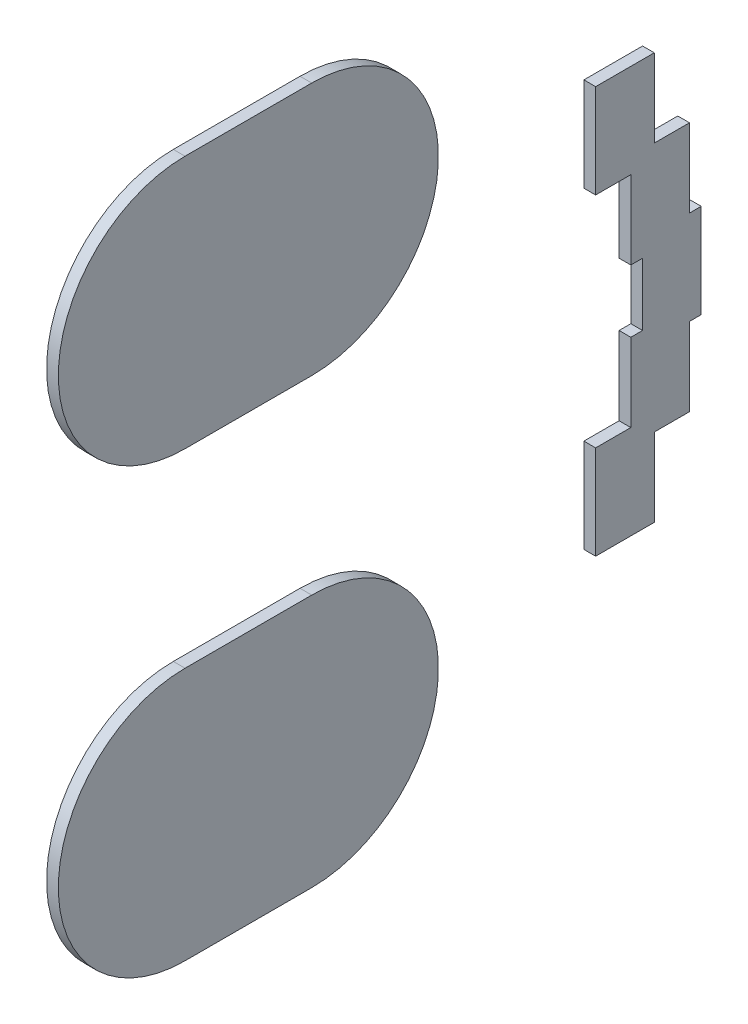
from build123d import *

# Parameters (mm, degrees)
S_BOX1_W      = 0.3
S_BOX1_H      = 6.48
BOSS_1_DEPTH  = 3.24
S_CYL2_R      = 3.24
BOSS_2_DEPTH  = 0.3
S_CYL3_R      = 3.24
BOSS_3_DEPTH  = 0.3
S_BOX4_W      = 0.3
S_BOX4_H      = 6.48
BOSS_4_DEPTH  = 3.24
S_CYL5_R      = 3.24
BOSS_5_DEPTH  = 0.3
S_CYL6_R      = 3.24
BOSS_6_DEPTH  = 0.3
S_BOX7_W      = 0.3
S_BOX7_H      = 2.4
BOSS_7_DEPTH  = 1.5
S_BOX8_W      = 0.3
S_BOX8_H      = 2.4
BOSS_8_DEPTH  = 1.5
S_BOX9_W      = 0.3
S_BOX9_H      = 2.4
BOSS_9_DEPTH  = 1.5
S_BOX10_W     = 0.3
S_BOX10_H     = 2.4
BOSS_10_DEPTH = 1.5
S_BOX11_W     = 0.3
S_BOX11_H     = 2.4
BOSS_11_DEPTH = 1.5


with BuildPart() as part:
    # S_box1 → Boss_1 (new body)
    with BuildSketch(Plane.XY.offset(30.81)):
        with Locations((29.65, 5.67)):
            Rectangle(S_BOX1_W, S_BOX1_H)
    extrude(amount=BOSS_1_DEPTH)

    # S_cyl2 → Boss_2 (add)
    with BuildSketch(Plane(origin=(29.5, 0, 0), x_dir=(0, 0, -1), z_dir=(1, 0, 0))):
        with Locations((-30.81, 5.67)):
            Circle(S_CYL2_R)
    extrude(amount=BOSS_2_DEPTH)

    # S_cyl3 → Boss_3 (add)
    with BuildSketch(Plane(origin=(29.5, 0, 0), x_dir=(0, 0, -1), z_dir=(1, 0, 0))):
        with Locations((-34.05, 5.67)):
            Circle(S_CYL3_R)
    extrude(amount=BOSS_3_DEPTH)


with BuildPart() as body_2:
    # S_box4 → Boss_4 (new body)
    with BuildSketch(Plane.XY.offset(30.81)):
        with Locations((29.65, -5.67)):
            Rectangle(S_BOX4_W, S_BOX4_H)
    extrude(amount=BOSS_4_DEPTH)

    # S_cyl5 → Boss_5 (add)
    with BuildSketch(Plane(origin=(29.5, 0, 0), x_dir=(0, 0, -1), z_dir=(1, 0, 0))):
        with Locations((-30.81, -5.67)):
            Circle(S_CYL5_R)
    extrude(amount=BOSS_5_DEPTH)

    # S_cyl6 → Boss_6 (add)
    with BuildSketch(Plane(origin=(29.5, 0, 0), x_dir=(0, 0, -1), z_dir=(1, 0, 0))):
        with Locations((-34.05, -5.67)):
            Circle(S_CYL6_R)
    extrude(amount=BOSS_6_DEPTH)


with BuildPart() as body_3:
    # S_box7 → Boss_7 (new body)
    with BuildSketch(Plane.XY.offset(22.05)):
        with Locations((29.65, -4)):
            Rectangle(S_BOX7_W, S_BOX7_H)
    extrude(amount=BOSS_7_DEPTH)

    # S_box8 → Boss_8 (add)
    with BuildSketch(Plane.XY.offset(21.15)):
        with Locations((29.65, -2)):
            Rectangle(S_BOX8_W, S_BOX8_H)
    extrude(amount=BOSS_8_DEPTH)

    # S_box9 → Boss_9 (add)
    with BuildSketch(Plane.XY.offset(20.85)):
        with Locations((29.65, 0)):
            Rectangle(S_BOX9_W, S_BOX9_H)
    extrude(amount=BOSS_9_DEPTH)

    # S_box10 → Boss_10 (add)
    with BuildSketch(Plane.XY.offset(21.15)):
        with Locations((29.65, 2)):
            Rectangle(S_BOX10_W, S_BOX10_H)
    extrude(amount=BOSS_10_DEPTH)

    # S_box11 → Boss_11 (add)
    with BuildSketch(Plane.XY.offset(22.05)):
        with Locations((29.65, 4)):
            Rectangle(S_BOX11_W, S_BOX11_H)
    extrude(amount=BOSS_11_DEPTH)


solid = Compound([part.part, body_2.part, body_3.part])
